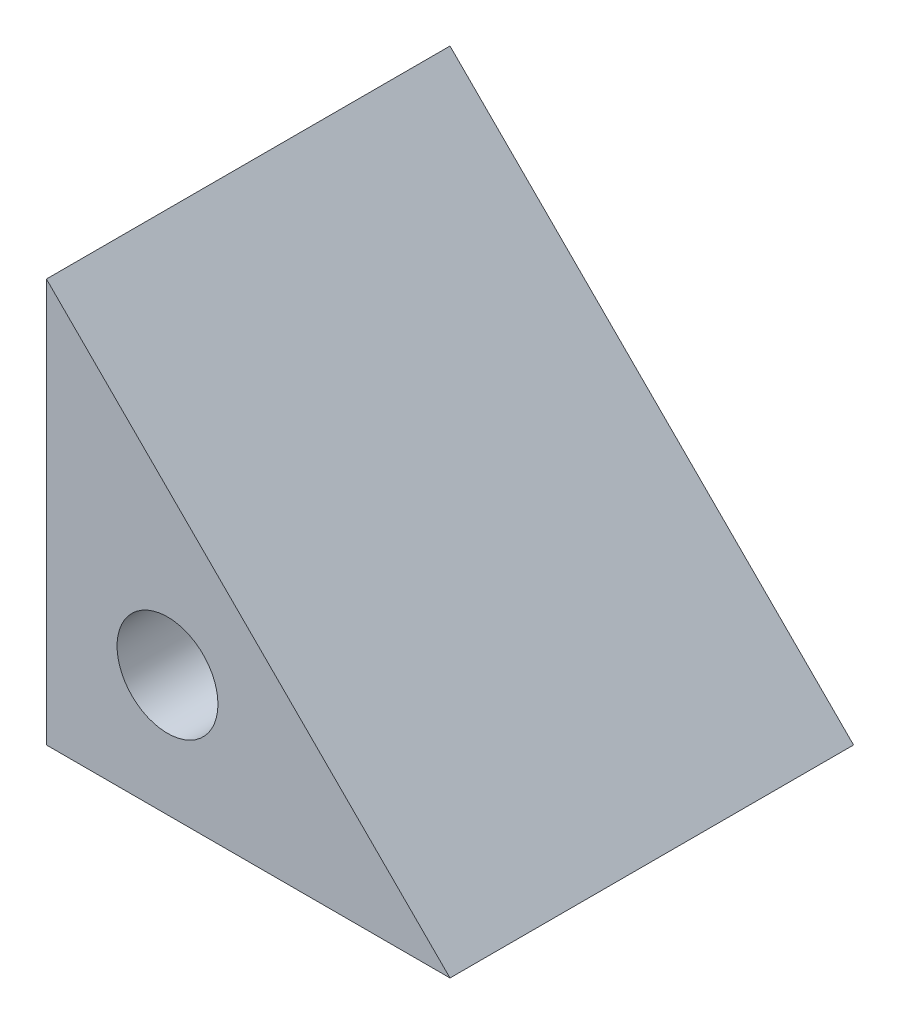
from build123d import *

# Parameters (mm, degrees)
SKETCH_1_R        = 5
EXTRUDE_387_DEPTH = 40


with BuildPart() as part:
    # Эскиз1 → Extrude 387 (new body)
    with BuildSketch(Plane.XY):
        Polygon((0, 0), (0, 40), (40, 0), align=None)
        with Locations((12, 12)):
            Circle(SKETCH_1_R, mode=Mode.SUBTRACT)
    extrude(amount=EXTRUDE_387_DEPTH)


solid = part.part
